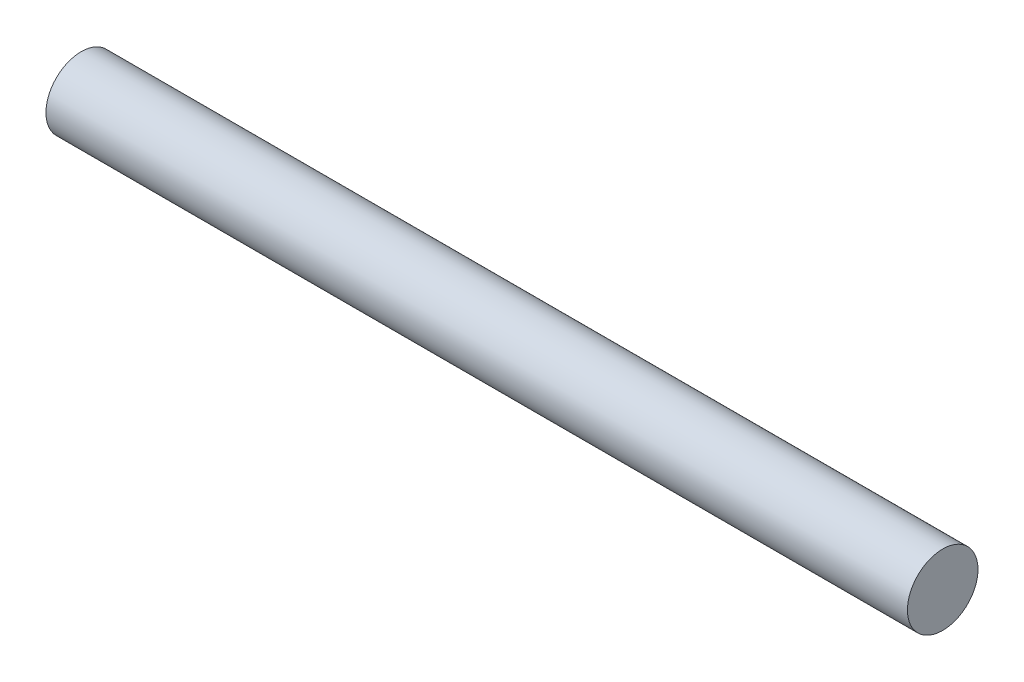
from build123d import *

# Parameters (mm, degrees)
SKETCH1_R           = 10.668
BOSS_EXTRUDE1_DEPTH = 260.35


with BuildPart() as part:
    # Sketch1 → Boss-Extrude1 (new body)
    with BuildSketch(Plane(origin=(0, 0, 0), x_dir=(0, 0, -1), z_dir=(1, 0, 0))):
        Circle(SKETCH1_R)
    extrude(amount=BOSS_EXTRUDE1_DEPTH)


solid = part.part
